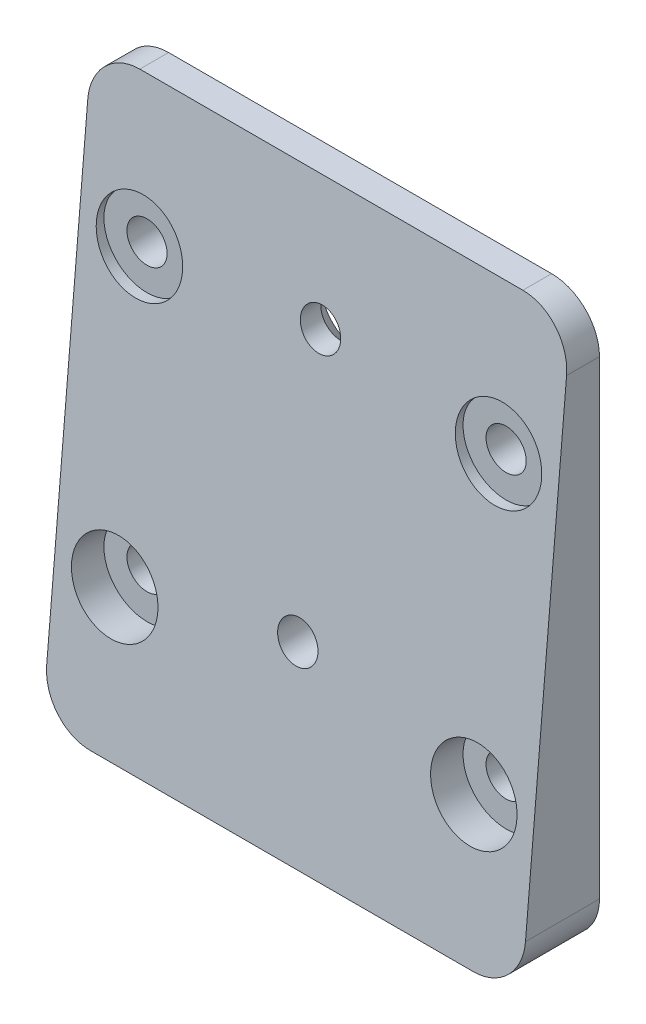
from build123d import *

# Parameters (mm, degrees)
SCHIZZO1_R                   = 2.1
ESTRUSIONE_ESTRUSIONE1_DEPTH = 3
SMUSSO1_SIZE                 = 2
ESTRUSIONE_ESTRUSIONE2_DEPTH = 50
SCHIZZO3_R                   = 2.1
TAGLIO_ESTRUSIONE1_DEPTH     = 10
RACCORDO1_R                  = 5
TAGLIO_ESTRUSIONE3_REACH     = 77.873
SCHIZZO5_R                   = 4.5


with BuildPart() as part:
    # Schizzo1 → Estrusione-Estrusione1 (new body)
    with BuildSketch(Plane.XY):
        Polygon((0, 71.847389048), (25, 71.847389048), (25, 12.801854913), (0, 12.801854913), (-25, 12.801854913), (-25, 71.847389048), align=None)
        with Locations((18.75, 57.086005514)):
            Circle(SCHIZZO1_R, mode=Mode.SUBTRACT)
        with Locations((18.75, 27.563238447)):
            Circle(SCHIZZO1_R, mode=Mode.SUBTRACT)
        with Locations(Location((-18.75, 27.563238447, 0), (0, 0, 180))):
            Circle(SCHIZZO1_R, mode=Mode.SUBTRACT)
        with Locations(Location((-18.75, 57.086005514, 0), (0, 0, 180))):
            Circle(SCHIZZO1_R, mode=Mode.SUBTRACT)
        with Locations((0, 58.89473309)):
            Circle(SCHIZZO1_R, mode=Mode.SUBTRACT)
        with Locations((0, 31.80362551)):
            Circle(SCHIZZO1_R, mode=Mode.SUBTRACT)
    extrude(amount=ESTRUSIONE_ESTRUSIONE1_DEPTH)

    # Smusso1
    smusso1_edges = [part.edges().sort_by_distance(p)[0] for p in [
        (-2.1, 58.89473309, 0),
        (-2.1, 31.80362551, 0),
    ]]
    chamfer(smusso1_edges, length=SMUSSO1_SIZE)

    # Schizzo2 → Estrusione-Estrusione2 (add)
    with BuildSketch(Plane(origin=(25, 0, 0), x_dir=(0, 0, -1), z_dir=(1, 0, 0))):
        Polygon((-3, 71.847389048), (-8.165814869, 12.801854913), (-3, 12.801854913), align=None)
    extrude(amount=-ESTRUSIONE_ESTRUSIONE2_DEPTH)

    # Schizzo3 → Taglio-Estrusione1 (cut)
    with BuildSketch(Plane(origin=(0, 0, 3), x_dir=(-1, 0, 0), z_dir=(0, 0, -1))):
        with Locations((18.75, 27.563238447)):
            Circle(SCHIZZO3_R)
        with Locations((18.75, 57.086005514)):
            Circle(SCHIZZO3_R)
        with Locations(Location((-18.75, 57.086005514, 0), (0, 0, 90))):
            Circle(SCHIZZO3_R)
        with Locations(Location((-18.75, 27.563238447, 0), (0, 0, 90))):
            Circle(SCHIZZO3_R)
        with Locations(Location((0, 31.80362551, 0), (0, 0, 90))):
            Circle(SCHIZZO3_R)
        with Locations(Location((0, 58.89473309, 0), (0, 0, 90))):
            Circle(SCHIZZO3_R)
    extrude(amount=-TAGLIO_ESTRUSIONE1_DEPTH, mode=Mode.SUBTRACT)

    # Raccordo1
    raccordo1_edges = [part.edges().sort_by_distance(p)[0] for p in [
        (25, 71.847389048, 1.5),
        (25, 12.801854913, 4.082907434),
        (-25, 12.801854913, 4.082907434),
        (-25, 71.847389048, 1.5),
    ]]
    fillet(raccordo1_edges, radius=RACCORDO1_R)

    # Taglio-Estrusione3: up to this plane
    taglio_estrusione3_end = Plane(origin=(0, 0, 3.5), z_dir=(0, 0, 1))
    # Schizzo5 → Taglio-Estrusione3 (cut, up to the surface)
    with BuildSketch(Plane(origin=(0, 0.806233906, 9.215295719), x_dir=(1, 0, 0), z_dir=(0, 0.08715574274765137, 0.9961946980917462)), mode=Mode.PRIVATE) as taglio_estrusione3_sk1:
        with Locations(Location((-18.75, 56.494751192, 0), (0, 0, 270))):
            Circle(SCHIZZO5_R)
    taglio_estrusione3_tool1 = split(extrude(taglio_estrusione3_sk1.sketch, amount=-TAGLIO_ESTRUSIONE3_REACH, mode=Mode.PRIVATE), bisect_by=taglio_estrusione3_end, keep=Keep.BOTH, mode=Mode.PRIVATE)
    add(taglio_estrusione3_tool1.solids().sort_by_distance((-18.75, 57.086006, 4.291454))[0], mode=Mode.SUBTRACT)
    # Schizzo5 → Taglio-Estrusione3 (cut, up to the surface)
    with BuildSketch(Plane(origin=(0, 0.806233906, 9.215295719), x_dir=(1, 0, 0), z_dir=(0, 0.08715574274765137, 0.9961946980917462)), mode=Mode.PRIVATE) as taglio_estrusione3_sk2:
        with Locations(Location((18.75, 56.494751192, 0), (0, 0, 270))):
            Circle(SCHIZZO5_R)
    taglio_estrusione3_tool2 = split(extrude(taglio_estrusione3_sk2.sketch, amount=-TAGLIO_ESTRUSIONE3_REACH, mode=Mode.PRIVATE), bisect_by=taglio_estrusione3_end, keep=Keep.BOTH, mode=Mode.PRIVATE)
    add(taglio_estrusione3_tool2.solids().sort_by_distance((18.75, 57.086006, 4.291454))[0], mode=Mode.SUBTRACT)
    # Schizzo5 → Taglio-Estrusione3 (cut, up to the surface)
    with BuildSketch(Plane(origin=(0, 0.806233906, 9.215295719), x_dir=(1, 0, 0), z_dir=(0, 0.08715574274765137, 0.9961946980917462)), mode=Mode.PRIVATE) as taglio_estrusione3_sk3:
        with Locations(Location((18.75, 26.859211951, 0), (0, 0, 270))):
            Circle(SCHIZZO5_R)
    taglio_estrusione3_tool3 = split(extrude(taglio_estrusione3_sk3.sketch, amount=-TAGLIO_ESTRUSIONE3_REACH, mode=Mode.PRIVATE), bisect_by=taglio_estrusione3_end, keep=Keep.BOTH, mode=Mode.PRIVATE)
    add(taglio_estrusione3_tool3.solids().sort_by_distance((18.75, 27.563238, 6.874361))[0], mode=Mode.SUBTRACT)
    # Schizzo5 → Taglio-Estrusione3 (cut, up to the surface)
    with BuildSketch(Plane(origin=(0, 0.806233906, 9.215295719), x_dir=(1, 0, 0), z_dir=(0, 0.08715574274765137, 0.9961946980917462)), mode=Mode.PRIVATE) as taglio_estrusione3_sk4:
        with Locations(Location((-18.75, 26.859211951, 0), (0, 0, 270))):
            Circle(SCHIZZO5_R)
    taglio_estrusione3_tool4 = split(extrude(taglio_estrusione3_sk4.sketch, amount=-TAGLIO_ESTRUSIONE3_REACH, mode=Mode.PRIVATE), bisect_by=taglio_estrusione3_end, keep=Keep.BOTH, mode=Mode.PRIVATE)
    add(taglio_estrusione3_tool4.solids().sort_by_distance((-18.75, 27.563238, 6.874361))[0], mode=Mode.SUBTRACT)


solid = part.part
